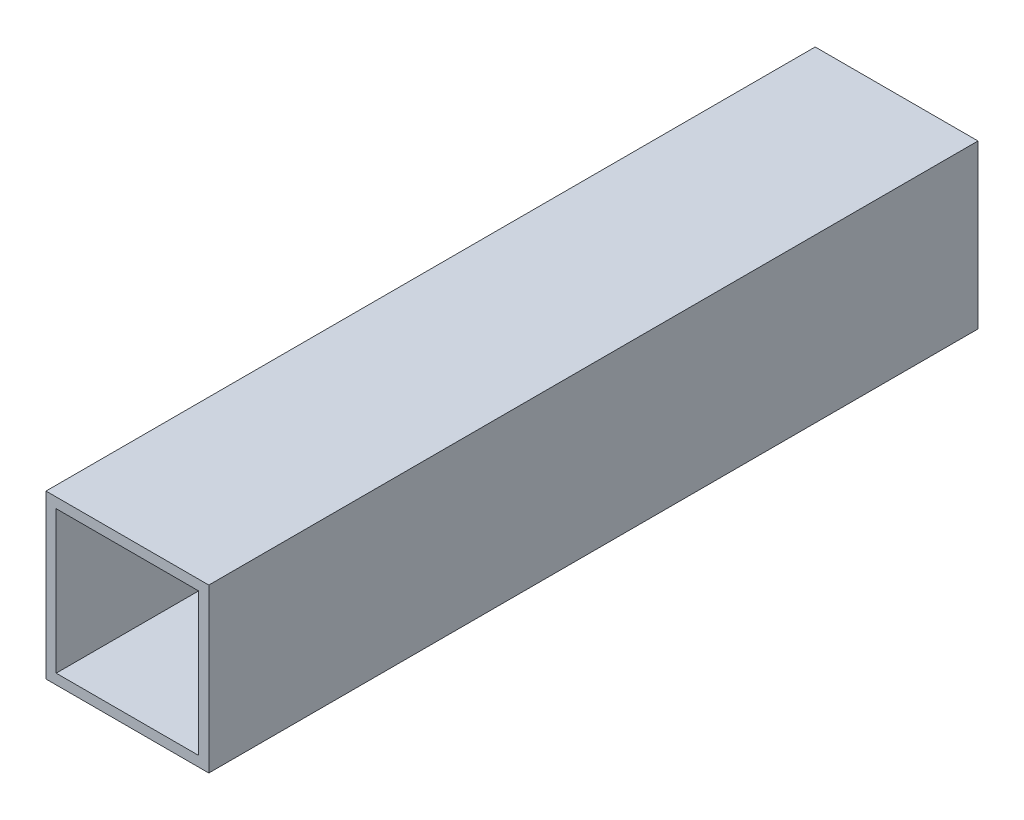
from build123d import *

# Parameters (mm, degrees)
SKETCH1_W           = 25.4
SKETCH1_H           = 25.4
SKETCH1_W_2         = 22.225
SKETCH1_H_2         = 22.225
BOSS_EXTRUDE1_DEPTH = 120


with BuildPart() as part:
    # Sketch1 → Boss-Extrude1 (new body)
    with BuildSketch(Plane.XY):
        Rectangle(SKETCH1_W, SKETCH1_H)
        Rectangle(SKETCH1_W_2, SKETCH1_H_2, mode=Mode.SUBTRACT)
    extrude(amount=BOSS_EXTRUDE1_DEPTH)


solid = part.part
